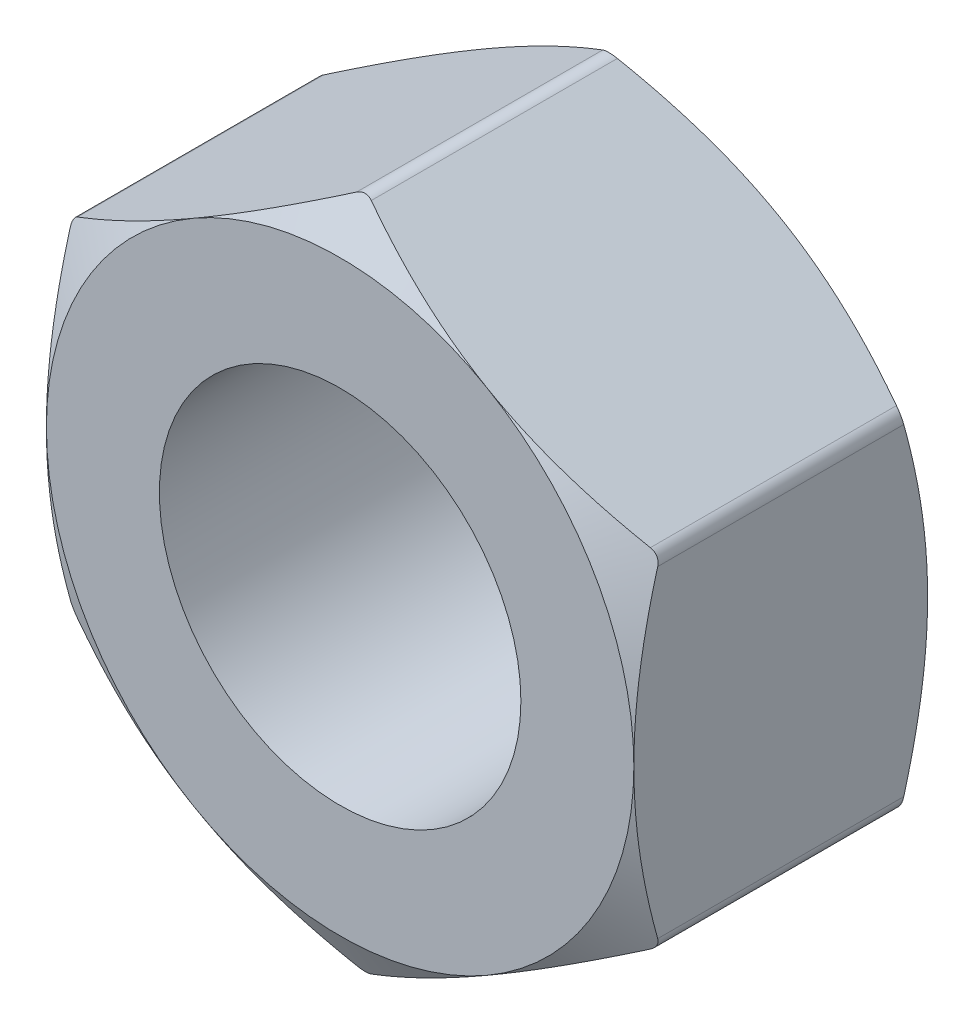
from build123d import *

# Parameters (mm, degrees)
BOSS_EXTRUDE2_DEPTH     = 3.25
CUT_EXTRUDE4_DEPTH      = 11.447288324
CUT_EXTRUDE4_DEPTH_BACK = 11.447288324
SKETCH16_R              = 4
SKETCH7_OUTSIDE_W       = 63.752
SKETCH7_OUTSIDE_H       = 65.764
SKETCH7_OUTSIDE_R       = 6.5
CUT_EXTRUDE5_DEPTH      = 12.867322079
CUT_EXTRUDE5_DRAFT      = -60
MIRROR4_COPY_1_SKETCH_W = 63.752
MIRROR4_COPY_1_SKETCH_H = 65.764
MIRROR4_COPY_1_SKETCH_R = 6.5
MIRROR4_COPY_1_DEPTH    = 12.867322079
MIRROR4_COPY_1_DRAFT    = -60
FILLET2_R               = 0.325


with BuildPart() as part:
    # Sketch15 → Boss-Extrude2 (new, symmetric)
    with BuildSketch(Plane.XY):
        Polygon((0, 7.505553499), (-6.5, 3.75277675), (-6.5, -3.75277675), (0, -7.505553499), (6.5, -3.75277675), (6.5, 3.75277675), align=None)
    extrude(amount=BOSS_EXTRUDE2_DEPTH, both=True)

    # Sketch16 → Cut-Extrude4 (cut, two sides: drawn at the far end of the back side and taken through both)
    with BuildSketch(Plane.XY.offset(-CUT_EXTRUDE4_DEPTH_BACK)):
        Circle(SKETCH16_R)
    extrude(amount=CUT_EXTRUDE4_DEPTH + CUT_EXTRUDE4_DEPTH_BACK, mode=Mode.SUBTRACT)


with BuildPart() as cut_extrude5_tool:
    # Sketch7 outside → Cut-Extrude5 (with draft: the straight prism first)
    with BuildSketch(Plane.XY.offset(3.25)):
        Rectangle(SKETCH7_OUTSIDE_W, SKETCH7_OUTSIDE_H)
        Circle(SKETCH7_OUTSIDE_R, mode=Mode.SUBTRACT)
    extrude(amount=-CUT_EXTRUDE5_DEPTH)
    # Cut-Extrude5: the draft: its side faces are tilted about the plane it starts from
    cut_extrude5_sides = [cut_extrude5_tool.faces().sort_by_distance(p)[0] for p in [
        (0, -32.882, -3.18366104),
        (31.876, 0, -3.18366104),
        (0, 32.882, -3.18366104),
        (-31.876, 0, -3.18366104),
        (-6.5, 0, -3.18366104),
    ]]
    draft(cut_extrude5_sides, Plane.XY.offset(3.25), CUT_EXTRUDE5_DRAFT)


with BuildPart() as part_1:
    add(part.part)

    # Cut-Extrude5: cut by cut_extrude5_tool
    add(cut_extrude5_tool.part, mode=Mode.SUBTRACT)


with BuildPart() as mirror4_copy_1_tool:
    # Mirror4 copy 1 sketch → Mirror4 copy 1 (with draft: the straight prism first)
    with BuildSketch(Plane(origin=(0, 0, -3.25), x_dir=(1, 0, 0), z_dir=(0, 0, -1))):
        Rectangle(MIRROR4_COPY_1_SKETCH_W, MIRROR4_COPY_1_SKETCH_H)
        Circle(MIRROR4_COPY_1_SKETCH_R, mode=Mode.SUBTRACT)
    extrude(amount=-MIRROR4_COPY_1_DEPTH)
    # Mirror4 copy 1: the draft: its side faces are tilted about the plane it starts from
    mirror4_copy_1_sides = [mirror4_copy_1_tool.faces().sort_by_distance(p)[0] for p in [
        (0, -32.882, 3.18366104),
        (31.876, 0, 3.18366104),
        (0, 32.882, 3.18366104),
        (-31.876, 0, 3.18366104),
        (-6.5, 0, 3.18366104),
    ]]
    draft(mirror4_copy_1_sides, Plane(origin=(0, 0, -3.25), x_dir=(1, 0, 0), z_dir=(0, 0, -1)), MIRROR4_COPY_1_DRAFT)


with BuildPart() as part_2:
    add(part_1.part)

    # Mirror4 copy 1: cut by mirror4_copy_1_tool
    add(mirror4_copy_1_tool.part, mode=Mode.SUBTRACT)

    # Fillet2
    fillet2_edges = [part_2.edges().sort_by_distance(p)[0] for p in [
        (-6.5, 3.75277675, 0),
        (-6.5, -3.75277675, 0),
        (0, -7.505553499, 0),
        (6.5, -3.75277675, 0),
        (6.5, 3.75277675, 0),
        (0, 7.505553499, 0),
    ]]
    fillet(fillet2_edges, radius=FILLET2_R)


solid = part_2.part
